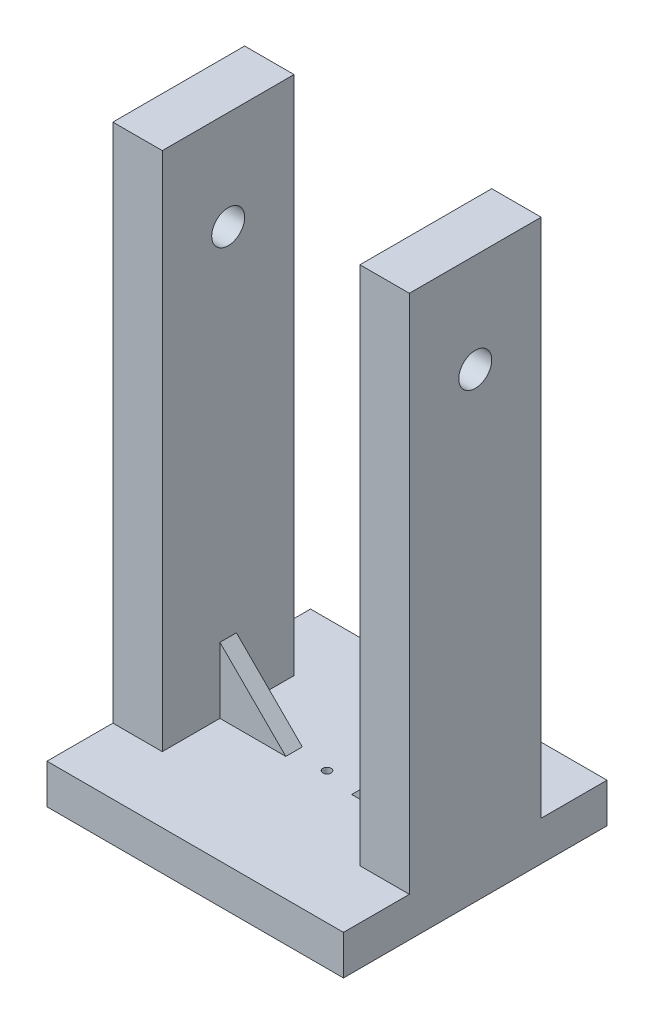
from build123d import *

# Parameters (mm, degrees)
SKETCH_1_W               = 90
SKETCH_1_H               = 80
EXTRUDE_1_DEPTH          = 12
SKETCH_2_W               = 15
SKETCH_2_H               = 40
EXTRUDE_2_DEPTH          = 158
CUT_EXTRUDE_1_DEPTH      = 181.346887969
CUT_EXTRUDE_1_DEPTH_BACK = 181.346887969
SKETCH_3_R               = 5
CUT_EXTRUDE_2_DEPTH      = 170.082819943
CUT_EXTRUDE_2_DEPTH_BACK = 10
SKETCH_4_R               = 1.25
RIB_6_REACH              = 182.347
SKETCH_6_WALL_W          = 28.284271248
SKETCH_6_WALL_H          = 5


with BuildPart() as part:
    # 草图1 → 凸台-拉伸1 (new body)
    with BuildSketch(Plane(origin=(0, 0, 0), x_dir=(1, 0, 0), z_dir=(0, 1, 0))):
        Rectangle(SKETCH_1_W, SKETCH_1_H)
    extrude(amount=EXTRUDE_1_DEPTH)

    # 草图2 → 凸台-拉伸2 (add)
    with BuildSketch(Plane(origin=(0, 12, 0), x_dir=(1, 0, 0), z_dir=(0, 1, 0))):
        with Locations((-37.5, 0)):
            Rectangle(SKETCH_2_W, SKETCH_2_H)
        with Locations((37.5, 0)):
            Rectangle(SKETCH_2_W, SKETCH_2_H)
    extrude(amount=EXTRUDE_2_DEPTH)

    # 草图3 → 切除-拉伸1 (cut, two sides: drawn at the far end of the back side and taken through both)
    with BuildSketch(Plane(origin=(0, 0, 0), x_dir=(0, 0, -1), z_dir=(1, 0, 0)).offset(-CUT_EXTRUDE_1_DEPTH_BACK)):
        with Locations((0, 140)):
            Circle(SKETCH_3_R)
    extrude(amount=CUT_EXTRUDE_1_DEPTH + CUT_EXTRUDE_1_DEPTH_BACK, mode=Mode.SUBTRACT)

    # 草图4 → 切除-拉伸2 (cut, two sides: drawn at the far end of the back side and taken through both)
    with BuildSketch(Plane(origin=(0, 12, 0), x_dir=(1, 0, 0), z_dir=(0, 1, 0)).offset(-CUT_EXTRUDE_2_DEPTH_BACK)):
        with Locations(Location((0, 0, 0), (0, 0, 270))):
            Circle(SKETCH_4_R)
    extrude(amount=CUT_EXTRUDE_2_DEPTH + CUT_EXTRUDE_2_DEPTH_BACK, mode=Mode.SUBTRACT)

    # 草图6 wall → 筋6 (add, up to next)
    with BuildSketch(Plane(origin=(-20, 22, 0), x_dir=(0.707106781187, -0.707106781187, 0), z_dir=(0.707106781187, 0.707106781187, 0)), mode=Mode.PRIVATE) as rib_6_sk1:
        Rectangle(SKETCH_6_WALL_W, SKETCH_6_WALL_H)
    rib_6_tool1 = extrude(rib_6_sk1.sketch, amount=-RIB_6_REACH, mode=Mode.PRIVATE) - part.part
    rib_6 = rib_6_tool1.solids().sort_by_distance((-20, 22, 0))[0]
    add(rib_6)

    # 镜向1: 筋6 across plane
    add(rib_6.mirror(Plane(origin=(0, 0, 0), x_dir=(0, 0, 1), z_dir=(1, 0, 0))))


solid = part.part
